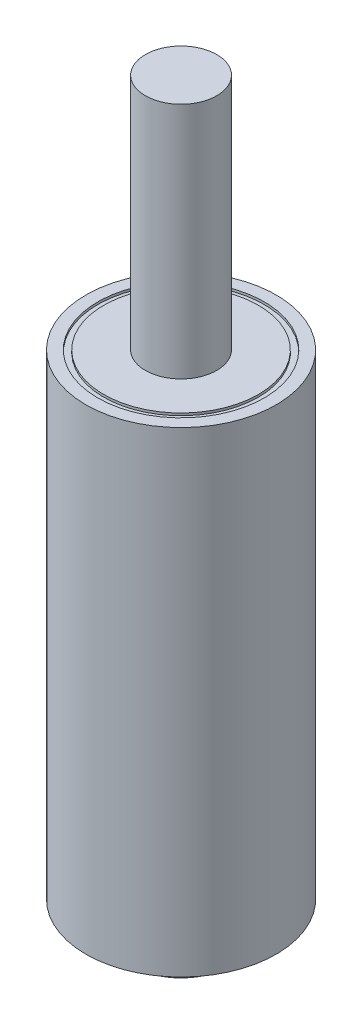
from build123d import *

# Parameters (mm, degrees)
SKETCH1_R               = 4
BOSS_EXTRUDE1_DEPTH     = 20
SKETCH2_R               = 3.5
SKETCH2_R_2             = 3.25
CUT_EXTRUDE_THIN1_DEPTH = 0.1
SKETCH3_R               = 2
BOSS_EXTRUDE2_DEPTH     = 0.2
FILLET1_R               = 0.1
SKETCH4_R               = 2
BOSS_EXTRUDE3_DEPTH     = 1
FILLET2_R               = 0.1
SKETCH5_R               = 1.25
BOSS_EXTRUDE4_DEPTH     = 0.5
CHAMFER1_SIZE           = 0.2
BOSS_EXTRUDE5_DEPTH     = 0.25
SKETCH7_R               = 1.5
BOSS_EXTRUDE6_DEPTH     = 10
CUT_EXTRUDE_THIN2_START = -0.1
SKETCH8_R               = 3.5
SKETCH8_R_2             = 3.25
CUT_EXTRUDE_THIN2_DEPTH = 0.1


with BuildPart() as part:
    # Sketch1 → Boss-Extrude1 (new body)
    with BuildSketch(Plane(origin=(0, 0, 0), x_dir=(1, 0, 0), z_dir=(0, 1, 0))):
        with Locations(Location((0, 0, 0), (0, 0, 270))):
            Circle(SKETCH1_R)
    extrude(amount=BOSS_EXTRUDE1_DEPTH)

    # Sketch2 → Cut-Extrude-Thin1 (cut)
    with BuildSketch(Plane.XZ):
        Circle(SKETCH2_R)
        Circle(SKETCH2_R_2, mode=Mode.SUBTRACT)
    extrude(amount=-CUT_EXTRUDE_THIN1_DEPTH, mode=Mode.SUBTRACT)

    # Sketch3 → Boss-Extrude2 (add)
    with BuildSketch(Plane.XZ):
        with Locations(Location((0, 0, 0), (0, 0, 90))):
            Circle(SKETCH3_R)
    extrude(amount=BOSS_EXTRUDE2_DEPTH)

    # Fillet1
    fillet1_edges = [part.edges().sort_by_distance(p)[0] for p in [
        (0, -0.2, -2),
    ]]
    fillet(fillet1_edges, radius=FILLET1_R)

    # Sketch4 → Boss-Extrude3 (add)
    with BuildSketch(Plane.XZ.offset(0.2)):
        with Locations(Location((0, 0, 0), (0, 0, 90))):
            Circle(SKETCH4_R)
    extrude(amount=BOSS_EXTRUDE3_DEPTH)

    # Fillet2
    fillet2_edges = [part.edges().sort_by_distance(p)[0] for p in [
        (0, -1.2, -2),
    ]]
    fillet(fillet2_edges, radius=FILLET2_R)

    # Sketch5 → Boss-Extrude4 (add)
    with BuildSketch(Plane.XZ.offset(1.2)):
        with Locations(Location((0, 0, 0), (0, 0, 270))):
            Circle(SKETCH5_R)
    extrude(amount=BOSS_EXTRUDE4_DEPTH)

    # Chamfer1
    chamfer1_edges = [part.edges().sort_by_distance(p)[0] for p in [
        (0, -1.7, 1.25),
    ]]
    chamfer(chamfer1_edges, length=CHAMFER1_SIZE)

    # Sketch6 → Boss-Extrude5 (add)
    with BuildSketch(Plane.XZ.offset(1.2)):
        with BuildLine():
            Line((0, -1.25), (0, -2))
            ThreePointArc((0, -2), (-1.414213562, 1.414213562), (2, 0))
            Line((2, 0), (1.25, 0))
            ThreePointArc((1.25, 0), (-0.883883476, 0.883883476), (0, -1.25))
        make_face()
    extrude(amount=BOSS_EXTRUDE5_DEPTH)

    # Sketch7 → Boss-Extrude6 (add)
    with BuildSketch(Plane(origin=(0, 20, 0), x_dir=(1, 0, 0), z_dir=(0, 1, 0))):
        with Locations(Location((0, 0, 0), (0, 0, 270))):
            Circle(SKETCH7_R)
    extrude(amount=BOSS_EXTRUDE6_DEPTH)

    # Sketch8 → Cut-Extrude-Thin2 (cut)
    with BuildSketch(Plane(origin=(0, 20, 0), x_dir=(1, 0, 0), z_dir=(0, 1, 0)).offset(CUT_EXTRUDE_THIN2_START)):
        Circle(SKETCH8_R)
        Circle(SKETCH8_R_2, mode=Mode.SUBTRACT)
    extrude(amount=CUT_EXTRUDE_THIN2_DEPTH, mode=Mode.SUBTRACT)


solid = part.part
